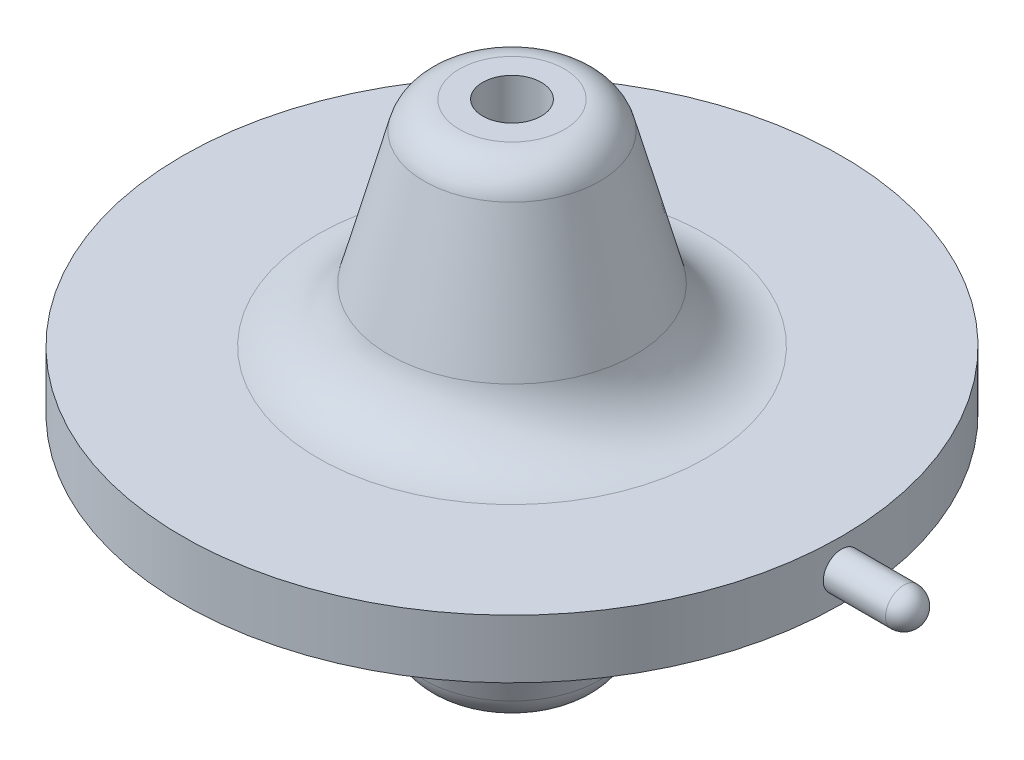
from build123d import *

# Parameters (mm, degrees)
SKETCH2_R          = 4
CUT_EXTRUDE1_DEPTH = 92.972604617


with BuildPart() as part:
    # Sketch1 → Revolve1 (revolve)
    with BuildSketch(Plane.XY):
        with BuildLine():
            Line((0, 33.2), (-7.16336506, 33.2))
            ThreePointArc((-7.16336506, 33.2), (-10.207172205, 32.166766701), (-11.992994192, 29.494095226))
            Line((-11.992994192, 29.494095226), (-16.838128036, 11.411809549))
            ThreePointArc((-16.838128036, 11.411809549), (-20.409772009, 6.066466597), (-26.497386299, 4))
            Line((-26.497386299, 4), (-45, 4))
            Line((-45, 4), (-45, -4))
            Line((-45, -4), (-26.497386299, -4))
            ThreePointArc((-26.497386299, -4), (-20.409772009, -6.066466597), (-16.838128036, -11.411809549))
            Line((-16.838128036, -11.411809549), (-11.992994192, -29.494095226))
            ThreePointArc((-11.992994192, -29.494095226), (-10.207172205, -32.166766701), (-7.16336506, -33.2))
            Line((-7.16336506, -33.2), (0, -33.2))
            Line((0, -33.2), (0, 33.2))
        make_face()
    revolve(axis=Axis((0, 33.2, 0), (0, -1, 0)))

    # Sketch2 → Cut-Extrude1 (cut, through all)
    with BuildSketch(Plane(origin=(0, 33.2, 0), x_dir=(1, 0, 0), z_dir=(0, 1, 0))):
        with Locations(Location((0, 0, 0), (0, 0, 270))):
            Circle(SKETCH2_R)
    extrude(amount=-CUT_EXTRUDE1_DEPTH, mode=Mode.SUBTRACT)


with BuildPart() as body_2:
    # Sketch3 → Revolve2 (revolve)
    with BuildSketch(Plane.XY):
        with BuildLine():
            Line((53.5, 2.5), (45, 2.5))
            Line((45, 2.5), (45, 0))
            Line((45, 0), (56, 0))
            ThreePointArc((56, 0), (55.267766953, 1.767766953), (53.5, 2.5))
        make_face()
    revolve(axis=Axis((0, 0, 0), (1, 0, 0)))


solid = Compound([part.part, body_2.part])
